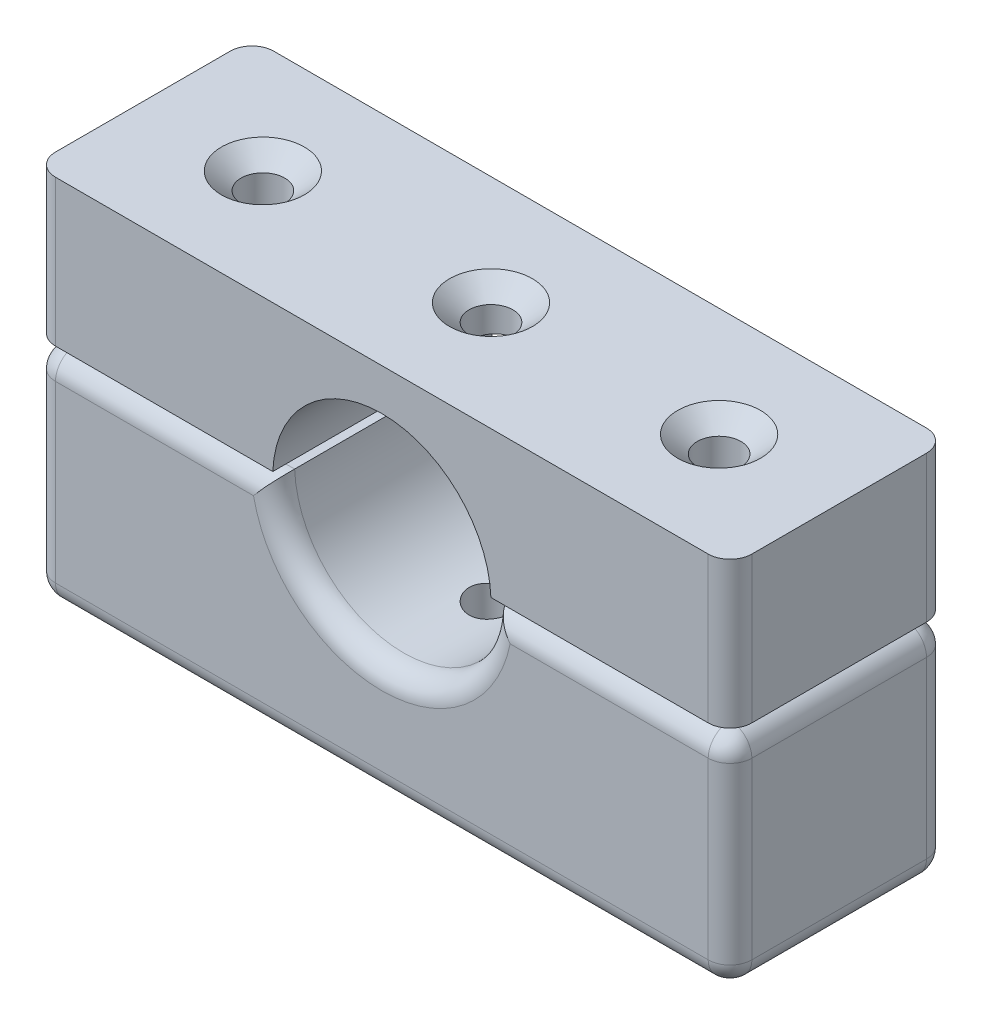
from build123d import *

# Parameters (mm, degrees)
BOSS_EXTRUDE1_DEPTH          = 25.4
BOSS_EXTRUDE1_2_DEPTH        = 25.4
CUT_EXTRUDE1_START           = -43.434
SKETCH3_R                    = 2.54
CUT_EXTRUDE1_DEPTH           = 43.434
SKETCH3_3_R                  = 4.826
CUT_EXTRUDE2_DEPTH           = 3.2258
CUT_EXTRUDE2_DRAFT           = -49
CUT_EXTRUDE2_PROFILE_2_DEPTH = 3.2258
CUT_EXTRUDE2_PROFILE_2_DRAFT = -49
CUT_EXTRUDE2_PROFILE_3_DEPTH = 3.2258
CUT_EXTRUDE2_PROFILE_3_DRAFT = -49
FILLET1_R                    = 2.54
FILLET2_R                    = 2.54
FILLET3_R                    = 2.54


with BuildPart() as part:
    # Sketch2 → Boss-Extrude1 (new body)
    with BuildSketch(Plane.XY):
        with BuildLine():
            Line((0, 43.434), (0, 26.416))
            Line((0, 26.416), (27.823164067, 26.416))
            ThreePointArc((27.823164067, 26.416), (40.513, 38.608), (53.202835933, 26.416))
            Line((53.202835933, 26.416), (81.026, 26.416))
            Line((81.026, 26.416), (81.026, 43.434))
            Line((81.026, 43.434), (0, 43.434))
        make_face()
    extrude(amount=BOSS_EXTRUDE1_DEPTH)


with BuildPart() as body_2:
    # Sketch2 → Boss-Extrude1 2 (new body)
    with BuildSketch(Plane.XY):
        with BuildLine():
            ThreePointArc((53.202835933, 25.4), (40.513, 13.208), (27.823164067, 25.4))
            Line((27.823164067, 25.4), (0, 25.4))
            Line((0, 25.4), (0, 0))
            Line((0, 0), (81.026, 0))
            Line((81.026, 0), (81.026, 25.4))
            Line((81.026, 25.4), (53.202835933, 25.4))
        make_face()
    extrude(amount=BOSS_EXTRUDE1_2_DEPTH)


with BuildPart() as cut_extrude1_tool:
    # Sketch3 → Cut-Extrude1 (new body)
    with BuildSketch(Plane(origin=(0, 43.434, 0), x_dir=(1, 0, 0), z_dir=(0, 1, 0)).offset(CUT_EXTRUDE1_START)):
        with Locations(Location((13.97, -12.7, 0), (0, 0, 270))):
            Circle(SKETCH3_R)
        with Locations(Location((40.513, -12.7, 0), (0, 0, 270))):
            Circle(SKETCH3_R)
        with Locations(Location((67.056, -12.7, 0), (0, 0, 270))):
            Circle(SKETCH3_R)
    extrude(amount=CUT_EXTRUDE1_DEPTH)


with BuildPart() as part_1:
    add(part.part)

    # Cut-Extrude1: cut by cut_extrude1_tool
    add(cut_extrude1_tool.part, mode=Mode.SUBTRACT)


with BuildPart() as body_2_1:
    add(body_2.part)

    # Cut-Extrude1: cut by cut_extrude1_tool
    add(cut_extrude1_tool.part, mode=Mode.SUBTRACT)

    # Fillet1
    fillet1_edges = [body_2_1.edges().sort_by_distance(p)[0] for p in [
        (13.911582034, 25.4, 25.4),
        (81.026, 25.4, 12.7),
        (0, 25.4, 12.7),
        (0, 12.7, 25.4),
        (81.026, 12.7, 25.4),
        (67.114417966, 25.4, 25.4),
        (40.513, 13.208, 25.4),
        (67.114417966, 25.4, 0),
        (81.026, 12.7, 0),
        (0, 12.7, 0),
        (13.911582034, 25.4, 0),
        (40.513, 13.208, 0),
    ]]
    fillet(fillet1_edges, radius=FILLET1_R)

    # Fillet3
    fillet3_edges = [body_2_1.edges().sort_by_distance(p)[0] for p in [
        (81.026, 0, 12.7),
        (40.513, 0, 0),
        (40.513, 0, 25.4),
        (0, 0, 12.7),
        (80.282051224, 0, 24.656051224),
        (0.743948776, 0, 24.656051224),
        (0.743948776, 0, 0.743948776),
        (80.282051224, 0, 0.743948776),
    ]]
    fillet(fillet3_edges, radius=FILLET3_R)


with BuildPart() as cut_extrude2_tool:
    # Sketch3<3> → Cut-Extrude2 (with draft: the straight prism first)
    with BuildSketch(Plane(origin=(0, 43.434, 0), x_dir=(1, 0, 0), z_dir=(0, 1, 0))):
        with Locations((40.513, -12.7)):
            Circle(SKETCH3_3_R)
    extrude(amount=-CUT_EXTRUDE2_DEPTH)
    # Cut-Extrude2: the draft: its side faces are tilted about the plane it starts from
    cut_extrude2_sides = [cut_extrude2_tool.faces().sort_by_distance(p)[0] for p in [
        (35.687, 41.8211, 12.7),
    ]]
    draft(cut_extrude2_sides, Plane(origin=(0, 43.434, 0), x_dir=(1, 0, 0), z_dir=(0, 1, 0)), CUT_EXTRUDE2_DRAFT)


with BuildPart() as part_2:
    add(part_1.part)

    # Cut-Extrude2: cut by cut_extrude2_tool
    add(cut_extrude2_tool.part, mode=Mode.SUBTRACT)


with BuildPart() as cut_extrude2_profile_2_tool:
    # Sketch3<3> → Cut-Extrude2 profile 2 (with draft: the straight prism first)
    with BuildSketch(Plane(origin=(0, 43.434, 0), x_dir=(1, 0, 0), z_dir=(0, 1, 0))):
        with Locations((13.97, -12.7)):
            Circle(SKETCH3_3_R)
    extrude(amount=-CUT_EXTRUDE2_PROFILE_2_DEPTH)
    # Cut-Extrude2 profile 2: the draft: its side faces are tilted about the plane it starts from
    cut_extrude2_profile_2_sides = [cut_extrude2_profile_2_tool.faces().sort_by_distance(p)[0] for p in [
        (9.144, 41.8211, 12.7),
    ]]
    draft(cut_extrude2_profile_2_sides, Plane(origin=(0, 43.434, 0), x_dir=(1, 0, 0), z_dir=(0, 1, 0)), CUT_EXTRUDE2_PROFILE_2_DRAFT)


with BuildPart() as part_3:
    add(part_2.part)

    # Cut-Extrude2 profile 2: cut by cut_extrude2_profile_2_tool
    add(cut_extrude2_profile_2_tool.part, mode=Mode.SUBTRACT)


with BuildPart() as cut_extrude2_profile_3_tool:
    # Sketch3<3> → Cut-Extrude2 profile 3 (with draft: the straight prism first)
    with BuildSketch(Plane(origin=(0, 43.434, 0), x_dir=(1, 0, 0), z_dir=(0, 1, 0))):
        with Locations((67.056, -12.7)):
            Circle(SKETCH3_3_R)
    extrude(amount=-CUT_EXTRUDE2_PROFILE_3_DEPTH)
    # Cut-Extrude2 profile 3: the draft: its side faces are tilted about the plane it starts from
    cut_extrude2_profile_3_sides = [cut_extrude2_profile_3_tool.faces().sort_by_distance(p)[0] for p in [
        (62.23, 41.8211, 12.7),
    ]]
    draft(cut_extrude2_profile_3_sides, Plane(origin=(0, 43.434, 0), x_dir=(1, 0, 0), z_dir=(0, 1, 0)), CUT_EXTRUDE2_PROFILE_3_DRAFT)


with BuildPart() as part_4:
    add(part_3.part)

    # Cut-Extrude2 profile 3: cut by cut_extrude2_profile_3_tool
    add(cut_extrude2_profile_3_tool.part, mode=Mode.SUBTRACT)

    # Fillet2
    fillet2_edges = [part_4.edges().sort_by_distance(p)[0] for p in [
        (81.026, 34.925, 25.4),
        (0, 34.925, 25.4),
        (0, 34.925, 0),
        (81.026, 34.925, 0),
    ]]
    fillet(fillet2_edges, radius=FILLET2_R)


solid = Compound([body_2_1.part, part_4.part])
